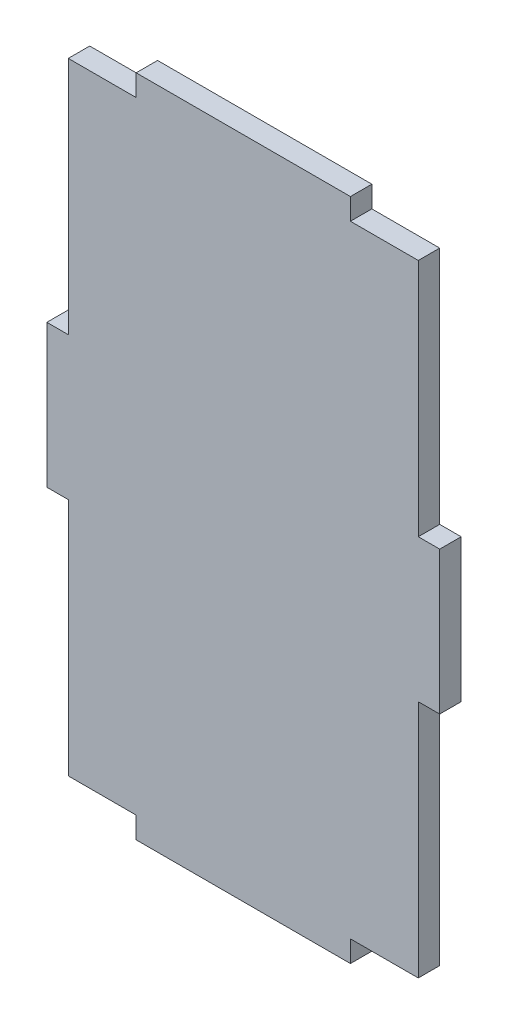
from build123d import *

# Parameters (mm, degrees)
SKETCH1_W           = 55
SKETCH1_H           = 93
BOSS_EXTRUDE1_DEPTH = 3
CUT_EXTRUDE2_DEPTH  = 3


with BuildPart() as part:
    # Sketch1 → Boss-Extrude1 (new body)
    with BuildSketch(Plane.XY):
        Rectangle(SKETCH1_W, SKETCH1_H)
    extrude(amount=BOSS_EXTRUDE1_DEPTH)

    # Sketch2 → Cut-Extrude2 (cut)
    with BuildSketch(Plane.XY.offset(3)):
        Polygon((-27.5, 46.5), (-19.5, 46.5), (-15, 46.5), (-15, 43.5), (-24.5, 43.5), (-24.5, 10), (-27.5, 10), align=None)
        Polygon((-27.5, -46.5), (-27.5, -10), (-24.5, -10), (-24.5, -43.5), (-15, -43.5), (-15, -46.5), (-19.5, -46.5), align=None)
        Polygon((27.5, -46.5), (19.5, -46.5), (15, -46.5), (15, -43.5), (24.5, -43.5), (24.5, -10), (27.5, -10), align=None)
        Polygon((27.5, 46.5), (27.5, 10), (24.5, 10), (24.5, 43.5), (15, 43.5), (15, 46.5), (19.5, 46.5), align=None)
    extrude(amount=-CUT_EXTRUDE2_DEPTH, mode=Mode.SUBTRACT)


solid = part.part
